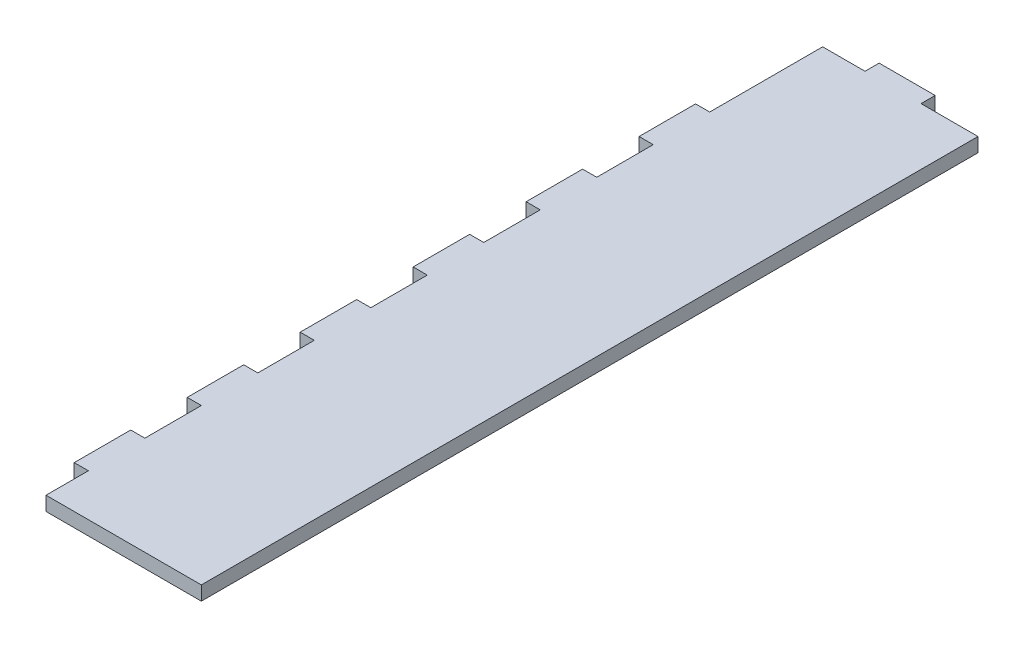
from build123d import *

# Parameters (mm, degrees)
SKETCH1_W           = 38.1
SKETCH1_H           = 177.8
BOSS_EXTRUDE1_DEPTH = 3.175
SKETCH2_W           = 3.175
SKETCH2_H           = 12.7
SKETCH2_H_2         = 9.525
SKETCH2_W_2         = 12.809265573
SKETCH2_H_3         = 3.175
CUT_EXTRUDE1_DEPTH  = 3.175


with BuildPart() as part:
    # Sketch1 → Boss-Extrude1 (new body)
    with BuildSketch(Plane(origin=(0, 0, 0), x_dir=(1, 0, 0), z_dir=(0, 1, 0))):
        Rectangle(SKETCH1_W, SKETCH1_H)
    extrude(amount=BOSS_EXTRUDE1_DEPTH)

    # Sketch2 → Cut-Extrude1 (cut)
    with BuildSketch(Plane(origin=(0, 3.175, 0), x_dir=(1, 0, 0), z_dir=(0, 1, 0))):
        Polygon((-6.35, 88.9), (-6.35, 85.725), (-15.875, 85.725), (-15.875, 60.325), (-19.05, 60.325), (-19.05, 88.9), (-15.875, 88.9), align=None)
        with Locations((-17.4625, 15.875)):
            Rectangle(SKETCH2_W, SKETCH2_H)
        with Locations((-17.4625, 41.275)):
            Rectangle(SKETCH2_W, SKETCH2_H)
        with Locations((-17.4625, -9.525)):
            Rectangle(SKETCH2_W, SKETCH2_H)
        with Locations((-17.4625, -34.925)):
            Rectangle(SKETCH2_W, SKETCH2_H)
        with Locations((-17.4625, -60.325)):
            Rectangle(SKETCH2_W, SKETCH2_H)
        with Locations((-17.4625, -84.1375)):
            Rectangle(SKETCH2_W, SKETCH2_H_2)
        with Locations((12.645367214, 87.3125)):
            Rectangle(SKETCH2_W_2, SKETCH2_H_3)
    extrude(amount=-CUT_EXTRUDE1_DEPTH, mode=Mode.SUBTRACT)


solid = part.part
